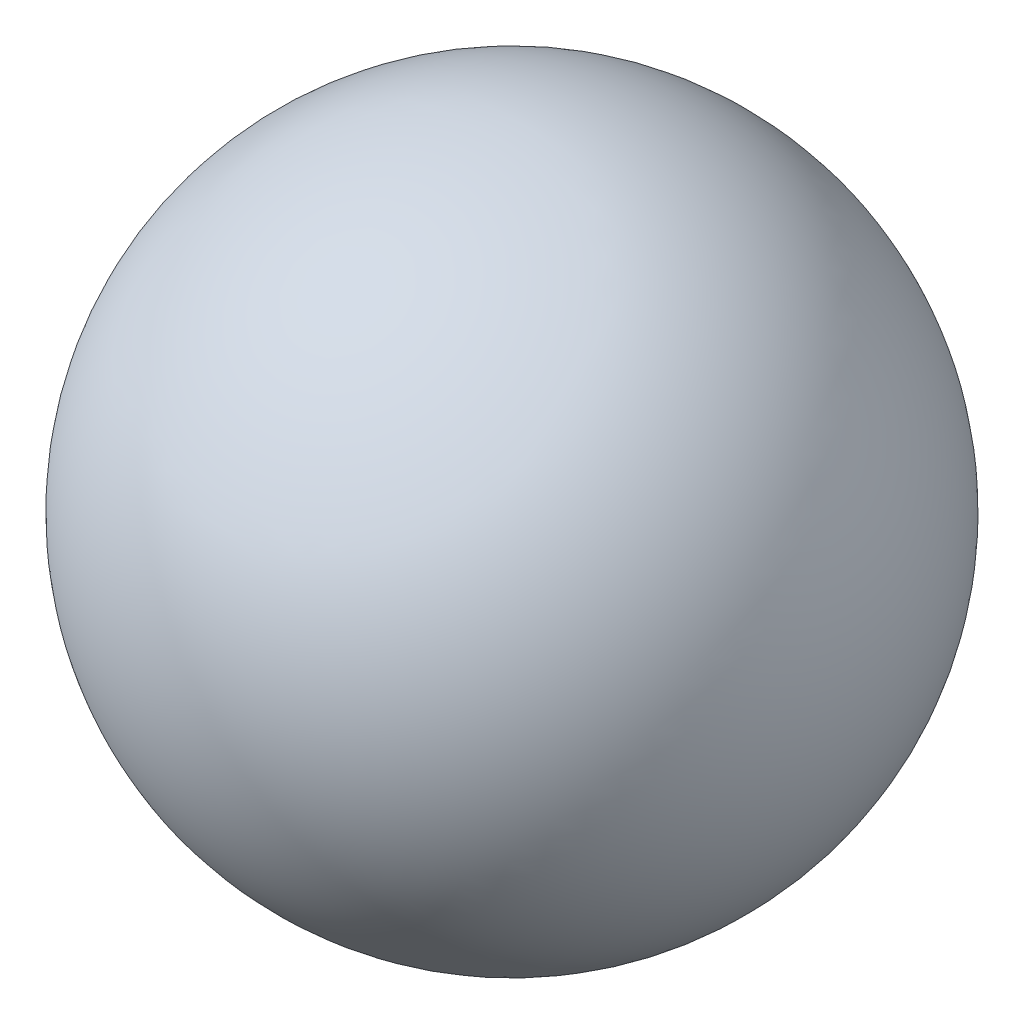
from build123d import *


with BuildPart() as part:
    # Sketch4 → Revolve4 (revolve)
    with BuildSketch(Plane(origin=(0, 0, 0), x_dir=(0, 0, -1), z_dir=(1, 0, 0))):
        with BuildLine():
            Line((-1.904556828, 13), (1.904556828, 13))
            ThreePointArc((1.904556828, 13), (0, 14.904556828), (-1.904556828, 13))
        make_face()
    revolve(axis=Axis((0, 13, 1.904556828), (0, 0, -1)))


solid = part.part
